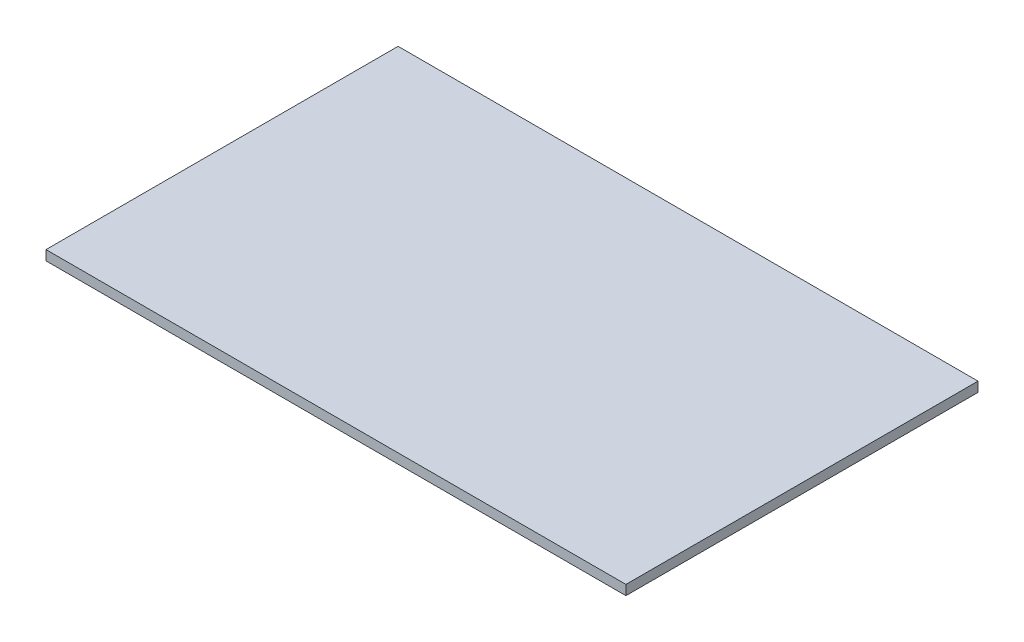
from build123d import *

# Parameters (mm, degrees)
SKETCH1_W           = 355.6
SKETCH1_H           = 215.9
BOSS_EXTRUDE1_DEPTH = 6


with BuildPart() as part:
    # Sketch1 → Boss-Extrude1 (new body)
    with BuildSketch(Plane(origin=(0, 0, 0), x_dir=(1, 0, 0), z_dir=(0, 1, 0))):
        Rectangle(SKETCH1_W, SKETCH1_H)
    extrude(amount=BOSS_EXTRUDE1_DEPTH)


solid = part.part
